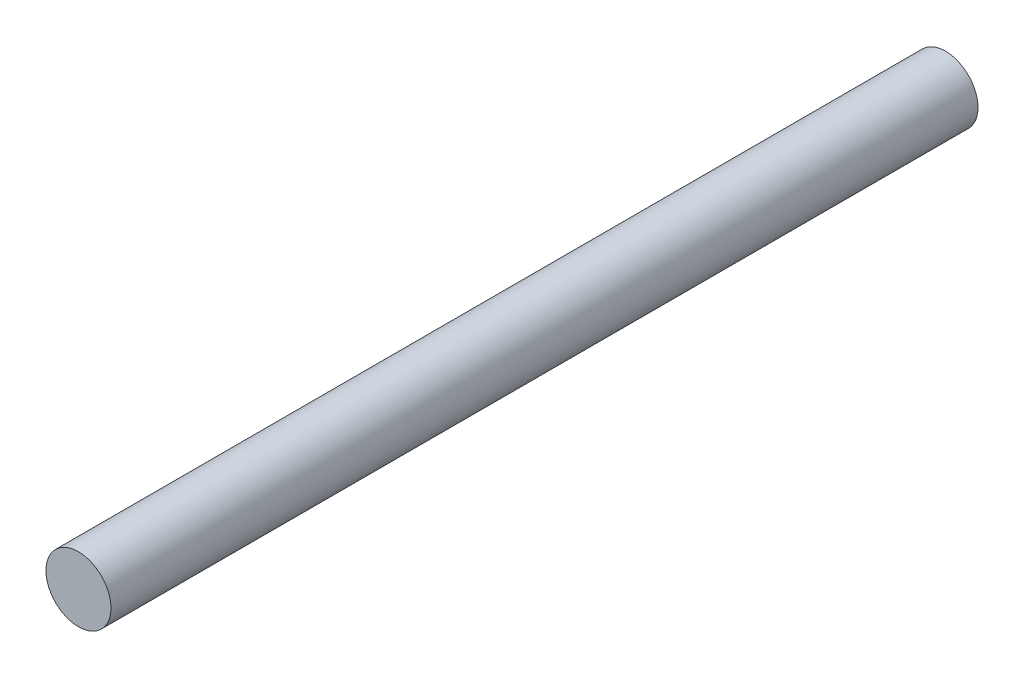
from build123d import *

# Parameters (mm, degrees)
ESQUISSE1_R        = 7.5
BOSS_EXTRU_1_DEPTH = 200


with BuildPart() as part:
    # Esquisse1 → Boss.-Extru.1 (new body)
    with BuildSketch(Plane.XY):
        Circle(ESQUISSE1_R)
    extrude(amount=BOSS_EXTRU_1_DEPTH)


solid = part.part
